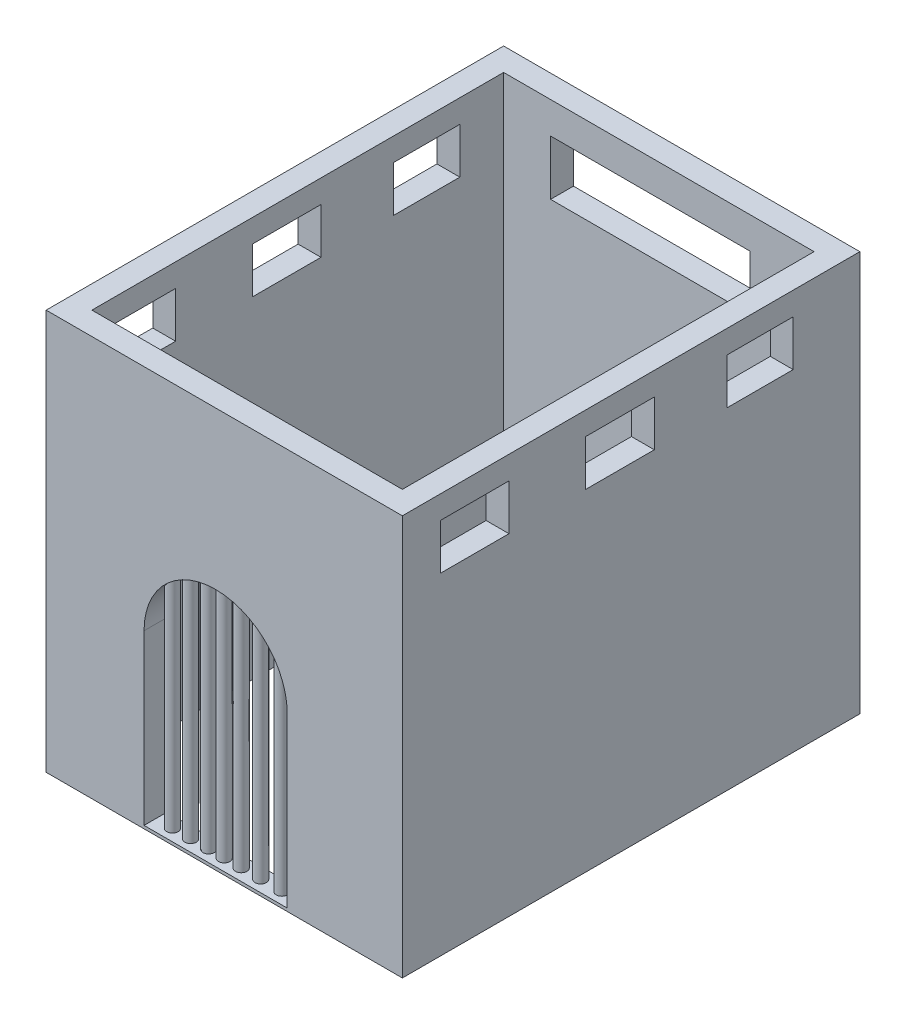
from build123d import *

# Parameters (mm, degrees)
SKETCH2_W           = 31146.161181759
SKETCH2_H           = 40000
SKETCH2_W_2         = 27146.161181759
SKETCH2_H_2         = 36000
BOSS_EXTRUDE1_DEPTH = 35000
CUT_EXTRUDE1_DEPTH  = 25931
SKETCH4_W           = 12516.832152794
SKETCH4_H           = 2000
BOSS_EXTRUDE2_DEPTH = 262
SKETCH5_R           = 500
BOSS_EXTRUDE3_DEPTH = 23635
SKETCH6_W           = 6000
SKETCH6_H           = 4000
SKETCH6_W_2         = 5780
SKETCH6_H_2         = 4000.000288557
CUT_EXTRUDE2_DEPTH  = 37179
SKETCH7_W           = 17423.589587964
SKETCH7_H           = 4795.967854712
CUT_EXTRUDE3_DEPTH  = 22021


with BuildPart() as part:
    # Sketch2 → Boss-Extrude1 (new body)
    with BuildSketch(Plane(origin=(0, 0, 0), x_dir=(1, 0, 0), z_dir=(0, 1, 0))):
        with Locations((754.848125938, 969.426853643)):
            Rectangle(SKETCH2_W, SKETCH2_H)
        with Locations((754.848125938, 969.426853643)):
            Rectangle(SKETCH2_W_2, SKETCH2_H_2, mode=Mode.SUBTRACT)
    extrude(amount=BOSS_EXTRUDE1_DEPTH)

    # Sketch3 → Cut-Extrude1 (cut)
    with BuildSketch(Plane.XY.offset(19030.573146357)):
        with BuildLine():
            Line((-6258.416076397, 15000), (-6258.416076397, 0))
            Line((-6258.416076397, 0), (6258.416076397, 0))
            Line((6258.416076397, 0), (6258.416076397, 15000))
            ThreePointArc((6258.416076397, 15000), (0, 21258.416076397), (-6258.416076397, 15000))
        make_face()
    extrude(amount=-CUT_EXTRUDE1_DEPTH, mode=Mode.SUBTRACT)

    # Sketch4 → Boss-Extrude2 (add)
    with BuildSketch(Plane.XZ):
        with Locations((0, 18030.573146357)):
            Rectangle(SKETCH4_W, SKETCH4_H)
    extrude(amount=-BOSS_EXTRUDE2_DEPTH)

    # Sketch5 → Boss-Extrude3 (add)
    with BuildSketch(Plane(origin=(0, 262, 0), x_dir=(1, 0, 0), z_dir=(0, 1, 0))):
        with Locations(Location((-1622.729102602, -18016.613902406, 0), (0, 0, 90))):
            Circle(SKETCH5_R)
        with Locations(Location((-3195.795465912, -18016.613902406, 0), (0, 0, 90))):
            Circle(SKETCH5_R)
        with Locations(Location((-4792.099907975, -18016.613902406, 0), (0, 0, 90))):
            Circle(SKETCH5_R)
        with Locations(Location((-263.653864298, -18016.613902406, 0), (0, 0, 90))):
            Circle(SKETCH5_R)
        with Locations(Location((1225.230638434, -18016.613902406, 0), (0, 0, 90))):
            Circle(SKETCH5_R)
        with Locations(Location((2925.277087323, -18016.613902406, 0), (0, 0, 90))):
            Circle(SKETCH5_R)
        with Locations(Location((4780.957085975, -18016.613902406, 0), (0, 0, 90))):
            Circle(SKETCH5_R)
    extrude(amount=BOSS_EXTRUDE3_DEPTH)

    # Sketch6 → Cut-Extrude2 (cut)
    with BuildSketch(Plane(origin=(16327.928716817, 0, 0), x_dir=(0, 0, -1), z_dir=(1, 0, 0))):
        with Locations((0, 30983.717544396)):
            Rectangle(SKETCH6_W, SKETCH6_H)
        with Locations((-12709.981459228, 30983.717544396)):
            Rectangle(SKETCH6_W, SKETCH6_H)
        with Locations((12250.851239159, 30983.717400118)):
            Rectangle(SKETCH6_W_2, SKETCH6_H_2)
    extrude(amount=-CUT_EXTRUDE2_DEPTH, mode=Mode.SUBTRACT)

    # Sketch7 → Cut-Extrude3 (cut)
    with BuildSketch(Plane(origin=(0, 0, -20969.426853643), x_dir=(-1, 0, 0), z_dir=(0, 0, -1))):
        with Locations((0, 29839.225215431)):
            Rectangle(SKETCH7_W, SKETCH7_H)
    extrude(amount=-CUT_EXTRUDE3_DEPTH, mode=Mode.SUBTRACT)


solid = part.part
